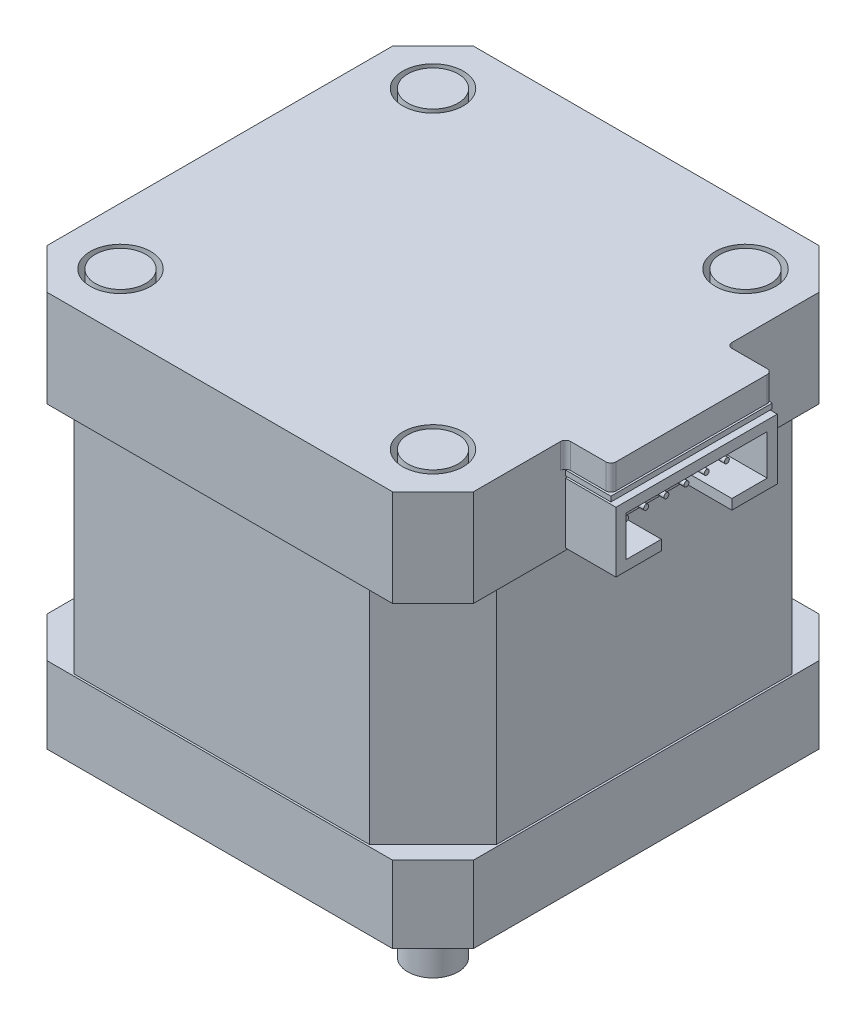
from build123d import *

# Parameters (mm, degrees)
SKETCH1_W               = 42.3
SKETCH1_H               = 42.3
BOSS_EXTRUDE1_DEPTH     = 39.25
CHAMFER1_SIZE           = 4
SKETCH2_W               = 10
SKETCH2_H               = 22.05
CUT_EXTRUDE1_DEPTH      = 1.9
MIRROR2_COPY_1_SKETCH_W = 10
MIRROR2_COPY_1_SKETCH_H = 22.05
MIRROR2_COPY_1_DEPTH    = 1.9
SKETCH3_R               = 11
BOSS_EXTRUDE2_DEPTH     = 1.9
CUT_EXTRUDE2_START      = -2
SKETCH4_R               = 11.5
SKETCH4_R_2             = 11
CUT_EXTRUDE2_DEPTH      = 2
SKETCH5_R               = 4.5
CUT_EXTRUDE3_DEPTH      = 2
SKETCH6_R               = 2.5
BOSS_EXTRUDE3_DEPTH     = 20
CUT_EXTRUDE4_START      = -15
CUT_EXTRUDE4_DEPTH      = 15
SKETCH8_R               = 1.5
CUT_EXTRUDE5_DEPTH      = 4
SKETCH10_W              = 30.925988462
SKETCH10_H              = 22.05
CUT_EXTRUDE6_DEPTH      = 0.2
CIRPATTERN1_COUNT       = 4
SKETCH11_W              = 16
SKETCH11_H              = 2.5
BOSS_EXTRUDE4_DEPTH     = 4.5
FILLET1_R               = 0.5
SKETCH12_W              = 16
SKETCH12_H              = 0.5
BOSS_EXTRUDE5_DEPTH     = 4.5
BOSS_EXTRUDE6_DEPTH     = 5
SKETCH14_R              = 0.25
BOSS_EXTRUDE7_DEPTH     = 3
SKETCH15_R              = 3
SKETCH15_R_2            = 2.5
CUT_EXTRUDE7_DEPTH      = 3


with BuildPart() as part:
    # Sketch1 → Boss-Extrude1 (new body)
    with BuildSketch(Plane(origin=(0, 0, 0), x_dir=(1, 0, 0), z_dir=(0, 1, 0))):
        Rectangle(SKETCH1_W, SKETCH1_H)
    extrude(amount=BOSS_EXTRUDE1_DEPTH)

    # Chamfer1
    chamfer1_edges = [part.edges().sort_by_distance(p)[0] for p in [
        (21.15, 19.625, 21.15),
        (-21.15, 19.625, 21.15),
        (-21.15, 19.625, -21.15),
        (21.15, 19.625, -21.15),
    ]]
    chamfer(chamfer1_edges, length=CHAMFER1_SIZE)

    # Sketch2 → Cut-Extrude1 (cut)
    with BuildSketch(Plane(origin=(19.15, 0, -19.15), x_dir=(-0.7071067811865462, 0, -0.7071067811865488), z_dir=(0.7071067811865488, 0, -0.7071067811865462))):
        with Locations((0.001572875, 18.625)):
            Rectangle(SKETCH2_W, SKETCH2_H)
    cut_extrude1 = extrude(amount=-CUT_EXTRUDE1_DEPTH, mode=Mode.SUBTRACT)

    # Mirror1: Cut-Extrude1 across plane
    add(cut_extrude1.mirror(Plane.XY), mode=Mode.SUBTRACT)

    # Mirror2: Cut-Extrude1 across plane
    add(cut_extrude1.mirror(Plane(origin=(0, 0, 0), x_dir=(0, 0, 1), z_dir=(1, 0, 0))), mode=Mode.SUBTRACT)

    # Mirror2 copy 1 sketch → Mirror2 copy 1 (cut)
    with BuildSketch(Plane(origin=(-19.15, 0, 19.15), x_dir=(0.7071067811865462, 0, 0.7071067811865488), z_dir=(-0.7071067811865488, 0, 0.7071067811865462))):
        with Locations((0.001572875, 18.625)):
            Rectangle(MIRROR2_COPY_1_SKETCH_W, MIRROR2_COPY_1_SKETCH_H)
    extrude(amount=-MIRROR2_COPY_1_DEPTH, mode=Mode.SUBTRACT)

    # Sketch3 → Boss-Extrude2 (add)
    with BuildSketch(Plane.XZ):
        with Locations(Location((0, 0, 0), (0, 0, 90))):
            Circle(SKETCH3_R)
    extrude(amount=BOSS_EXTRUDE2_DEPTH)

    # Sketch4 → Cut-Extrude2 (cut)
    with BuildSketch(Plane.XZ.offset(CUT_EXTRUDE2_START)):
        with Locations(Location((0, 0, 0), (0, 0, 270))):
            Circle(SKETCH4_R)
        with Locations(Location((0, 0, 0), (0, 0, 90))):
            Circle(SKETCH4_R_2, mode=Mode.SUBTRACT)
    extrude(amount=CUT_EXTRUDE2_DEPTH, mode=Mode.SUBTRACT)

    # Sketch5 → Cut-Extrude3 (cut)
    with BuildSketch(Plane.XZ.offset(1.9)):
        with Locations(Location((0, 0, 0), (0, 0, 270))):
            Circle(SKETCH5_R)
    extrude(amount=-CUT_EXTRUDE3_DEPTH, mode=Mode.SUBTRACT)

    # Sketch6 → Boss-Extrude3 (add)
    with BuildSketch(Plane.XZ.offset(-0.1)):
        with Locations(Location((0, 0, 0), (0, 0, 270))):
            Circle(SKETCH6_R)
    extrude(amount=BOSS_EXTRUDE3_DEPTH)

    # Sketch7 → Cut-Extrude4 (cut)
    with BuildSketch(Plane.XZ.offset(19.9).offset(CUT_EXTRUDE4_START)):
        with BuildLine():
            Line((-2.5, 0), (0, -2.5))
            ThreePointArc((0, -2.5), (-1.767766953, -1.767766953), (-2.5, 0))
        make_face()
    extrude(amount=CUT_EXTRUDE4_DEPTH, mode=Mode.SUBTRACT)

    # Sketch8 → Cut-Extrude5 (cut)
    with BuildSketch(Plane.XZ):
        with Locations(Location((-15.5, 15.5, 0), (0, 0, 270))):
            Circle(SKETCH8_R)
        with Locations(Location((15.5, 15.5, 0), (0, 0, 270))):
            Circle(SKETCH8_R)
        with Locations(Location((15.5, -15.5, 0), (0, 0, 270))):
            Circle(SKETCH8_R)
        with Locations(Location((-15.5, -15.5, 0), (0, 0, 270))):
            Circle(SKETCH8_R)
    extrude(amount=-CUT_EXTRUDE5_DEPTH, mode=Mode.SUBTRACT)

    # Sketch10 → Cut-Extrude6 (cut)
    with BuildSketch(Plane.ZY.offset(21.15)):
        with Locations((0, 18.625)):
            Rectangle(SKETCH10_W, SKETCH10_H)
    cut_extrude6 = extrude(amount=-CUT_EXTRUDE6_DEPTH, mode=Mode.SUBTRACT)

    # CirPattern1: Cut-Extrude6 ×4 about axis
    cirpattern1_axis = Axis((0, 0, 0), (0, 1, 0))
    for i in range(1, CIRPATTERN1_COUNT):
        add(cut_extrude6.rotate(cirpattern1_axis, i * 360 / CIRPATTERN1_COUNT), mode=Mode.SUBTRACT)

    # Sketch11 → Boss-Extrude4 (add)
    with BuildSketch(Plane(origin=(21.15, 0, 0), x_dir=(0, 0, -1), z_dir=(1, 0, 0))):
        with Locations((0, 38)):
            Rectangle(SKETCH11_W, SKETCH11_H)
    extrude(amount=BOSS_EXTRUDE4_DEPTH)

    # Fillet1
    fillet1_edges = [part.edges().sort_by_distance(p)[0] for p in [
        (21.15, 38, 8),
        (21.15, 38, -8),
        (25.65, 38, 8),
        (25.65, 38, -8),
    ]]
    fillet(fillet1_edges, radius=FILLET1_R)

    # Sketch12 → Boss-Extrude5 (add)
    with BuildSketch(Plane(origin=(21.15, 0, 0), x_dir=(0, 0, -1), z_dir=(1, 0, 0))):
        with Locations((0, 36.3)):
            Rectangle(SKETCH12_W, SKETCH12_H)
    extrude(amount=BOSS_EXTRUDE5_DEPTH)

    # Sketch13 → Boss-Extrude6 (add)
    with BuildSketch(Plane(origin=(21.15, 0, 0), x_dir=(0, 0, -1), z_dir=(1, 0, 0))):
        Polygon((-3.5, 30.85), (-3.5, 29.85), (-8, 29.85), (-8, 35.85), (8, 35.85), (8, 29.85), (3.5, 29.85), (3.5, 30.85), (7, 30.85), (7, 34.85), (-7, 34.85), (-7, 30.85), align=None)
    extrude(amount=BOSS_EXTRUDE6_DEPTH)

    # Sketch14 → Boss-Extrude7 (add)
    with BuildSketch(Plane(origin=(21.15, 0, 0), x_dir=(0, 0, -1), z_dir=(1, 0, 0))):
        with Locations(Location((-5, 32.35, 0), (0, 0, 180))):
            Circle(SKETCH14_R)
        with Locations(Location((-3, 32.35, 0), (0, 0, 180))):
            Circle(SKETCH14_R)
        with Locations(Location((-1, 32.35, 0), (0, 0, 180))):
            Circle(SKETCH14_R)
        with Locations(Location((1, 32.35, 0), (0, 0, 180))):
            Circle(SKETCH14_R)
        with Locations(Location((3, 32.35, 0), (0, 0, 180))):
            Circle(SKETCH14_R)
        with Locations(Location((5, 32.35, 0), (0, 0, 180))):
            Circle(SKETCH14_R)
    extrude(amount=BOSS_EXTRUDE7_DEPTH)

    # Sketch15 → Cut-Extrude7 (cut)
    # profile 1 of 4: a face of its own
    with BuildSketch(Plane(origin=(0, 39.25, 0), x_dir=(1, 0, 0), z_dir=(0, 1, 0))):
        with Locations(Location((-15.5, 15.5, 0), (0, 0, 270))):
            Circle(SKETCH15_R)
        with Locations(Location((-15.5, 15.5, 0), (0, 0, 270))):
            Circle(SKETCH15_R_2, mode=Mode.SUBTRACT)
    # profile 2 of 4: a face of its own
    with BuildSketch(Plane(origin=(0, 39.25, 0), x_dir=(1, 0, 0), z_dir=(0, 1, 0))):
        with Locations(Location((15.5, 15.5, 0), (0, 0, 270))):
            Circle(SKETCH15_R)
        with Locations(Location((15.5, 15.5, 0), (0, 0, 270))):
            Circle(SKETCH15_R_2, mode=Mode.SUBTRACT)
    # profile 3 of 4: a face of its own
    with BuildSketch(Plane(origin=(0, 39.25, 0), x_dir=(1, 0, 0), z_dir=(0, 1, 0))):
        with Locations(Location((15.5, -15.5, 0), (0, 0, 270))):
            Circle(SKETCH15_R)
        with Locations(Location((15.5, -15.5, 0), (0, 0, 270))):
            Circle(SKETCH15_R_2, mode=Mode.SUBTRACT)
    # profile 4 of 4: a face of its own
    with BuildSketch(Plane(origin=(0, 39.25, 0), x_dir=(1, 0, 0), z_dir=(0, 1, 0))):
        with Locations(Location((-15.5, -15.5, 0), (0, 0, 270))):
            Circle(SKETCH15_R)
        with Locations(Location((-15.5, -15.5, 0), (0, 0, 270))):
            Circle(SKETCH15_R_2, mode=Mode.SUBTRACT)
    extrude(amount=-CUT_EXTRUDE7_DEPTH, mode=Mode.SUBTRACT)


solid = part.part
